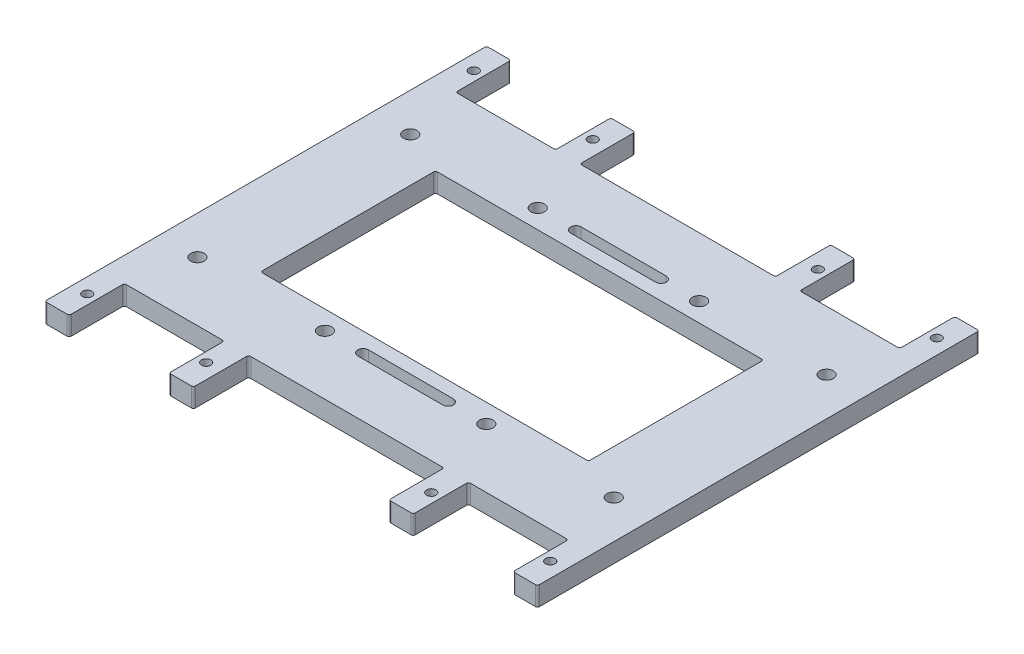
from build123d import *

# Parameters (mm, degrees)
EXTRUDE_1_DEPTH     = 4.5
SKETCH_10_W         = 77.2
SKETCH_10_H         = 41.2
CUT_EXTRUDE_5_DEPTH = 79.027238834
SKETCH_16_R         = 1.6
CUT_EXTRUDE_6_DEPTH = 10
SKETCH_17_R         = 1.1
CUT_EXTRUDE_7_DEPTH = 10
FILLET_1_R          = 0.5


with BuildPart() as part:
    # 草图1 → 凸台-拉伸1 (new body)
    with BuildSketch(Plane(origin=(0, 0, 0), x_dir=(1, 0, 0), z_dir=(0, 1, 0))):
        Polygon((-58, -39), (-58, -52), (-52.25, -52), (-52.25, -39), (-28.75, -39), (-28.75, -52), (-23, -52), (-23, -39), (23, -39), (23, -52), (28.75, -52), (28.75, -39), (52.25, -39), (52.25, -52), (58, -52), (58, -39), (58, 39), (58, 52), (52.25, 52), (52.25, 39), (28.75, 39), (28.75, 52), (23, 52), (23, 39), (-23, 39), (-23, 52), (-28.75, 52), (-28.75, 39), (-52.25, 39), (-52.25, 52), (-58, 52), (-58, 39), align=None)
    extrude(amount=-EXTRUDE_1_DEPTH)

    # 草图10 → 切除-拉伸5 (cut, through all)
    with BuildSketch(Plane(origin=(0, 0, 0), x_dir=(1, 0, 0), z_dir=(0, 1, 0))):
        Rectangle(SKETCH_10_W, SKETCH_10_H)
    extrude(amount=-CUT_EXTRUDE_5_DEPTH, mode=Mode.SUBTRACT)

    # 草图16 → 切除-拉伸6 (cut)
    with BuildSketch(Plane(origin=(0, 0, 0), x_dir=(1, 0, 0), z_dir=(0, 1, 0))):
        with Locations(Location((19, 25.05, 0), (0, 0, 270))):
            Circle(SKETCH_16_R)
        with Locations(Location((49, 25.05, 0), (0, 0, 270))):
            Circle(SKETCH_16_R)
        with Locations(Location((-49, 25.05, 0), (0, 0, 90))):
            Circle(SKETCH_16_R)
        with Locations(Location((-19, 25.05, 0), (0, 0, 90))):
            Circle(SKETCH_16_R)
        with Locations(Location((49, -25.05, 0), (0, 0, 90))):
            Circle(SKETCH_16_R)
        with Locations(Location((19, -25.05, 0), (0, 0, 90))):
            Circle(SKETCH_16_R)
        with Locations(Location((-19, -25.05, 0), (0, 0, 270))):
            Circle(SKETCH_16_R)
        with Locations(Location((-49, -25.05, 0), (0, 0, 270))):
            Circle(SKETCH_16_R)
        with BuildLine():
            Line((-10, 26.3), (10, 26.3))
            ThreePointArc((10, 26.3), (11.25, 25.05), (10, 23.8))
            Line((10, 23.8), (-10, 23.8))
            ThreePointArc((-10, 23.8), (-11.25, 25.05), (-10, 26.3))
        make_face()
        with BuildLine():
            Line((-10, -26.3), (10, -26.3))
            ThreePointArc((10, -26.3), (11.25, -25.05), (10, -23.8))
            Line((10, -23.8), (-10, -23.8))
            ThreePointArc((-10, -23.8), (-11.25, -25.05), (-10, -26.3))
        make_face()
    extrude(amount=-CUT_EXTRUDE_6_DEPTH, mode=Mode.SUBTRACT)

    # 草图17 → 切除-拉伸7 (cut)
    with BuildSketch(Plane(origin=(0, 0, 0), x_dir=(1, 0, 0), z_dir=(0, 1, 0))):
        with Locations(Location((-54.5, -45.5, 0), (0, 0, 270))):
            Circle(SKETCH_17_R)
        with Locations(Location((-26.5, -45.5, 0), (0, 0, 270))):
            Circle(SKETCH_17_R)
        with Locations(Location((26.5, -45.5, 0), (0, 0, 90))):
            Circle(SKETCH_17_R)
        with Locations(Location((54.5, -45.5, 0), (0, 0, 90))):
            Circle(SKETCH_17_R)
        with Locations(Location((54.5, 45.5, 0), (0, 0, 270))):
            Circle(SKETCH_17_R)
        with Locations(Location((-26.5, 45.5, 0), (0, 0, 90))):
            Circle(SKETCH_17_R)
        with Locations(Location((-54.5, 45.5, 0), (0, 0, 90))):
            Circle(SKETCH_17_R)
        with Locations(Location((26.5, 45.5, 0), (0, 0, 270))):
            Circle(SKETCH_17_R)
    extrude(amount=-CUT_EXTRUDE_7_DEPTH, mode=Mode.SUBTRACT)

    # 圆角1
    fillet_1_edges = [part.edges().sort_by_distance(p)[0] for p in [
        (58, -2.25, 52),
        (52.25, -2.25, 52),
        (52.25, -2.25, 39),
        (28.75, -2.25, 39),
        (28.75, -2.25, 52),
        (23, -2.25, 52),
        (23, -2.25, 39),
        (-23, -2.25, 39),
        (-23, -2.25, 52),
        (-28.75, -2.25, 52),
        (-28.75, -2.25, 39),
        (-52.25, -2.25, 39),
        (-52.25, -2.25, 52),
        (-58, -2.25, 52),
        (-58, -2.25, -52),
        (-52.25, -2.25, -52),
        (-52.25, -2.25, -39),
        (-28.75, -2.25, -39),
        (-28.75, -2.25, -52),
        (-23, -2.25, -52),
        (-23, -2.25, -39),
        (23, -2.25, -39),
        (23, -2.25, -52),
        (28.75, -2.25, -52),
        (28.75, -2.25, -39),
        (52.25, -2.25, -39),
        (52.25, -2.25, -52),
        (58, -2.25, -52),
        (-38.6, -2.25, 20.6),
        (-38.6, -2.25, -20.6),
        (38.6, -2.25, -20.6),
        (38.6, -2.25, 20.6),
    ]]
    fillet(fillet_1_edges, radius=FILLET_1_R)


solid = part.part
